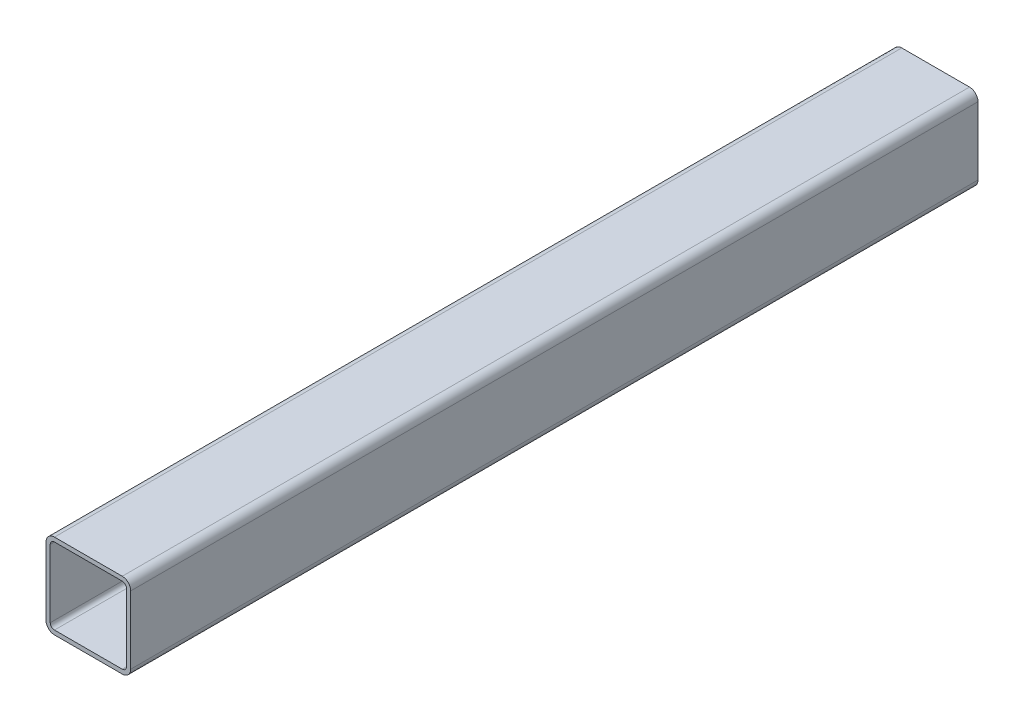
from build123d import *

# Parameters (mm, degrees)
SHS100X100X5_1_DEPTH = 1000


with BuildPart() as part:
    # Sketch11 → SHS100x100x5 (1) (new body)
    with BuildSketch(Plane.XY):
        with BuildLine():
            Line((-40, -50), (40, -50))
            ThreePointArc((40, -50), (47.071067812, -47.071067812), (50, -40))
            Line((50, -40), (50, 40))
            ThreePointArc((50, 40), (47.071067812, 47.071067812), (40, 50))
            Line((40, 50), (-40, 50))
            ThreePointArc((-40, 50), (-47.071067812, 47.071067812), (-50, 40))
            Line((-50, 40), (-50, -40))
            ThreePointArc((-50, -40), (-47.071067812, -47.071067812), (-40, -50))
        make_face()
        with BuildLine():
            Line((-40, -45), (40, -45))
            ThreePointArc((40, -45), (43.535533906, -43.535533906), (45, -40))
            Line((45, -40), (45, 40))
            ThreePointArc((45, 40), (43.535533906, 43.535533906), (40, 45))
            Line((40, 45), (-40, 45))
            ThreePointArc((-40, 45), (-43.535533906, 43.535533906), (-45, 40))
            Line((-45, 40), (-45, -40))
            ThreePointArc((-45, -40), (-43.535533906, -43.535533906), (-40, -45))
        make_face(mode=Mode.SUBTRACT)
    extrude(amount=SHS100X100X5_1_DEPTH)


solid = part.part
